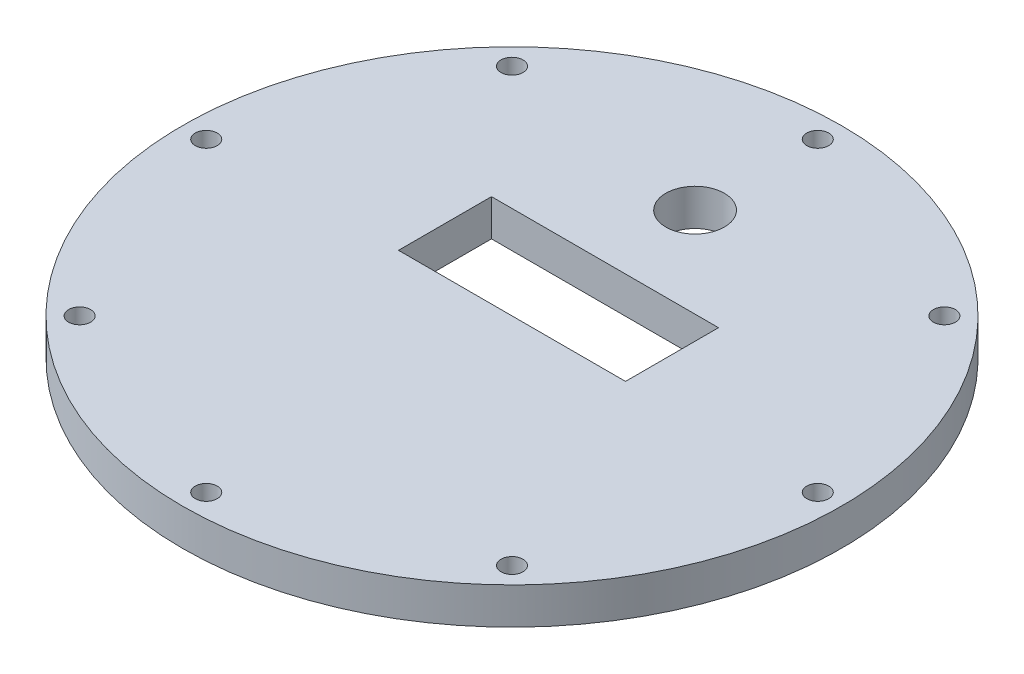
from build123d import *

# Parameters (mm, degrees)
SKETCH1_R           = 45
SKETCH1_R_2         = 1.5
BOSS_EXTRUDE2_DEPTH = 5
SKETCH2_W           = 31
SKETCH2_H           = 12.7
CUT_EXTRUDE2_DEPTH  = 10
SKETCH4_R           = 4
CUT_EXTRUDE6_DEPTH  = 10


with BuildPart() as part:
    # Sketch1 → Boss-Extrude2 (new body)
    with BuildSketch(Plane(origin=(0, 0, 0), x_dir=(1, 0, 0), z_dir=(0, 1, 0))):
        with Locations(Location((0, 0, 0), (0, 0, 270))):
            Circle(SKETCH1_R)
        with Locations(Location((0, 41.75, 0), (0, 0, 270))):
            Circle(SKETCH1_R_2, mode=Mode.SUBTRACT)
        with Locations(Location((29.521708115, 29.521708115, 0), (0, 0, 270))):
            Circle(SKETCH1_R_2, mode=Mode.SUBTRACT)
        with Locations(Location((41.75, 0, 0), (0, 0, 270))):
            Circle(SKETCH1_R_2, mode=Mode.SUBTRACT)
        with Locations(Location((29.521708115, -29.521708115, 0), (0, 0, 270))):
            Circle(SKETCH1_R_2, mode=Mode.SUBTRACT)
        with Locations(Location((0, -41.75, 0), (0, 0, 270))):
            Circle(SKETCH1_R_2, mode=Mode.SUBTRACT)
        with Locations(Location((-29.521708115, -29.521708115, 0), (0, 0, 270))):
            Circle(SKETCH1_R_2, mode=Mode.SUBTRACT)
        with Locations(Location((-41.75, 0, 0), (0, 0, 270))):
            Circle(SKETCH1_R_2, mode=Mode.SUBTRACT)
        with Locations(Location((-29.521708115, 29.521708115, 0), (0, 0, 270))):
            Circle(SKETCH1_R_2, mode=Mode.SUBTRACT)
    extrude(amount=BOSS_EXTRUDE2_DEPTH)

    # Sketch2 → Cut-Extrude2 (cut)
    with BuildSketch(Plane(origin=(0, 5, 0), x_dir=(1, 0, 0), z_dir=(0, 1, 0))):
        with Locations((0, 6.35)):
            Rectangle(SKETCH2_W, SKETCH2_H)
    extrude(amount=-CUT_EXTRUDE2_DEPTH, mode=Mode.SUBTRACT)

    # Sketch4 → Cut-Extrude6 (cut)
    with BuildSketch(Plane(origin=(0, 5, 0), x_dir=(1, 0, 0), z_dir=(0, 1, 0))):
        with Locations(Location((0, 25, 0), (0, 0, 270))):
            Circle(SKETCH4_R)
    extrude(amount=-CUT_EXTRUDE6_DEPTH, mode=Mode.SUBTRACT)


solid = part.part
